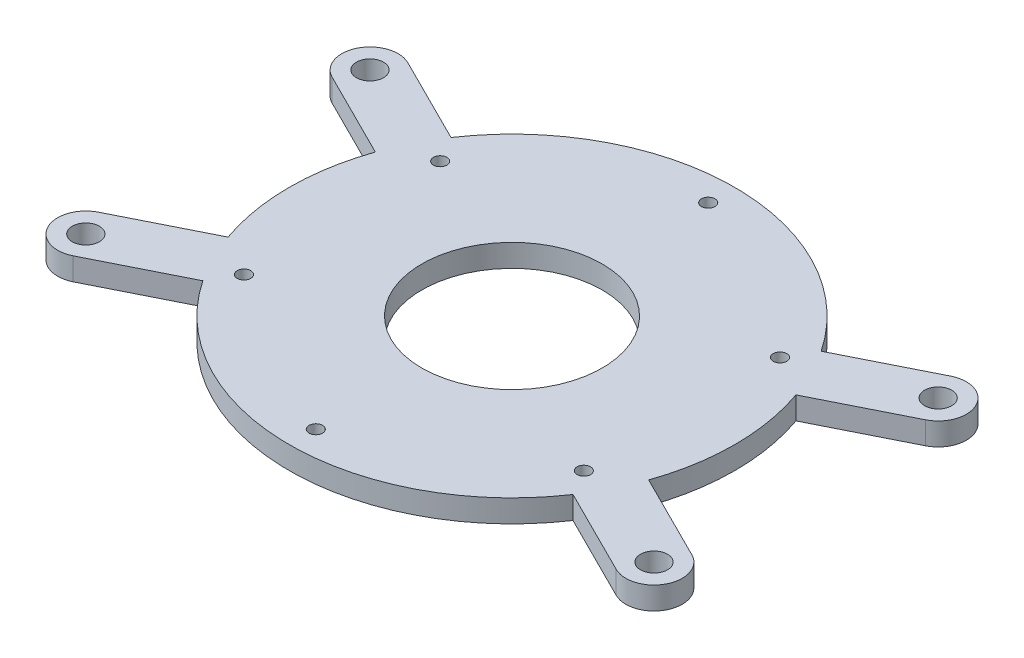
from build123d import *

# Parameters (mm, degrees)
SKETCH_1_R               = 20
EXTRUDE_1_DEPTH          = 5
CUT_EXTRUDE_1_REACH      = 87.2
SKETCH_2_R               = 3
MIRROR_2_COPY_1_REACH    = 87.2
MIRROR_2_COPY_1_SKETCH_R = 3
SKETCH_3_R               = 1.5
CUT_EXTRUDE_2_DEPTH      = 86.199993462
PATTERN_CIRCULAR_1_COUNT = 6


with BuildPart() as part:
    # 草图1 → 凸台-拉伸1 (new body)
    with BuildSketch(Plane(origin=(0, 0, 0), x_dir=(1, 0, 0), z_dir=(0, 1, 0))):
        with BuildLine():
            Line((46.623322285, 16.328680875), (65.781966365, 25.910071498))
            ThreePointArc((65.781966365, 25.910071498), (68.576327064, 34.295567803), (60.190830759, 37.089928502))
            Line((60.190830759, 37.089928502), (41.03218668, 27.50853788))
            ThreePointArc((41.03218668, 27.50853788), (0, 49.4), (-41.03218668, 27.50853788))
            Line((-41.03218668, 27.50853788), (-60.190830759, 37.089928502))
            ThreePointArc((-60.190830759, 37.089928502), (-68.576327064, 34.295567803), (-65.781966365, 25.910071498))
            Line((-65.781966365, 25.910071498), (-46.623322285, 16.328680875))
            ThreePointArc((-46.623322285, 16.328680875), (-49.4, 0), (-46.623322285, -16.328680875))
            Line((-46.623322285, -16.328680875), (-65.781966365, -25.910071498))
            ThreePointArc((-65.781966365, -25.910071498), (-68.576327064, -34.295567803), (-60.190830759, -37.089928502))
            Line((-60.190830759, -37.089928502), (-41.03218668, -27.50853788))
            ThreePointArc((-41.03218668, -27.50853788), (0, -49.4), (41.03218668, -27.50853788))
            Line((41.03218668, -27.50853788), (60.190830759, -37.089928502))
            ThreePointArc((60.190830759, -37.089928502), (68.576327064, -34.295567803), (65.781966365, -25.910071498))
            Line((65.781966365, -25.910071498), (46.623322285, -16.328680875))
            ThreePointArc((46.623322285, -16.328680875), (49.4, 0), (46.623322285, 16.328680875))
        make_face()
        with Locations(Location((0, 0, 0), (0, 0, 270))):
            Circle(SKETCH_1_R, mode=Mode.SUBTRACT)
    extrude(amount=EXTRUDE_1_DEPTH)

    # 草图2 → 切除-拉伸1 (cut, up to next)
    with BuildSketch(Plane(origin=(0, 5, 0), x_dir=(1, 0, 0), z_dir=(0, 1, 0)), mode=Mode.PRIVATE) as cut_extrude_1_sk1:
        with Locations(Location((-62.986398562, 31.5, 0), (0, 0, 270))):
            Circle(SKETCH_2_R)
    cut_extrude_1_tool1 = extrude(cut_extrude_1_sk1.sketch, amount=-CUT_EXTRUDE_1_REACH, mode=Mode.PRIVATE) & part.part
    cut_extrude_1 = cut_extrude_1_tool1.solids().sort_by_distance((-62.986399, 5, -31.5))[0]
    add(cut_extrude_1, mode=Mode.SUBTRACT)

    # 镜向1: 切除-拉伸1 across plane
    add(cut_extrude_1.mirror(Plane.XY), mode=Mode.SUBTRACT)

    # 镜向2: 切除-拉伸1 across plane
    add(cut_extrude_1.mirror(Plane(origin=(0, 0, 0), x_dir=(0, 0, 1), z_dir=(1, 0, 0))), mode=Mode.SUBTRACT)

    # 镜向2 copy 1 sketch → 镜向2 copy 1 (cut, up to next)
    with BuildSketch(Plane(origin=(0, 5, 0), x_dir=(-1, 0, 0), z_dir=(0, 1, 0)), mode=Mode.PRIVATE) as mirror_2_copy_1_sk1:
        with Locations(Location((-62.986398562, 31.5, 0), (0, 0, 270))):
            Circle(MIRROR_2_COPY_1_SKETCH_R)
    mirror_2_copy_1_tool1 = extrude(mirror_2_copy_1_sk1.sketch, amount=-MIRROR_2_COPY_1_REACH, mode=Mode.PRIVATE) & part.part
    add(mirror_2_copy_1_tool1.solids().sort_by_distance((62.986399, 5, 31.5))[0], mode=Mode.SUBTRACT)

    # 草图3 → 切除-拉伸2 (cut, through all)
    with BuildSketch(Plane.XZ):
        with Locations(Location((0, 43.5, 0), (0, 0, 270))):
            Circle(SKETCH_3_R)
    cut_extrude_2 = extrude(amount=-CUT_EXTRUDE_2_DEPTH, mode=Mode.SUBTRACT)

    # 阵列(圆周)1: 切除-拉伸2 ×6 about axis
    pattern_circular_1_axis = Axis((0, 0, 0), (0, 1, 0))
    for i in range(1, PATTERN_CIRCULAR_1_COUNT):
        add(cut_extrude_2.rotate(pattern_circular_1_axis, i * 360 / PATTERN_CIRCULAR_1_COUNT), mode=Mode.SUBTRACT)


solid = part.part
